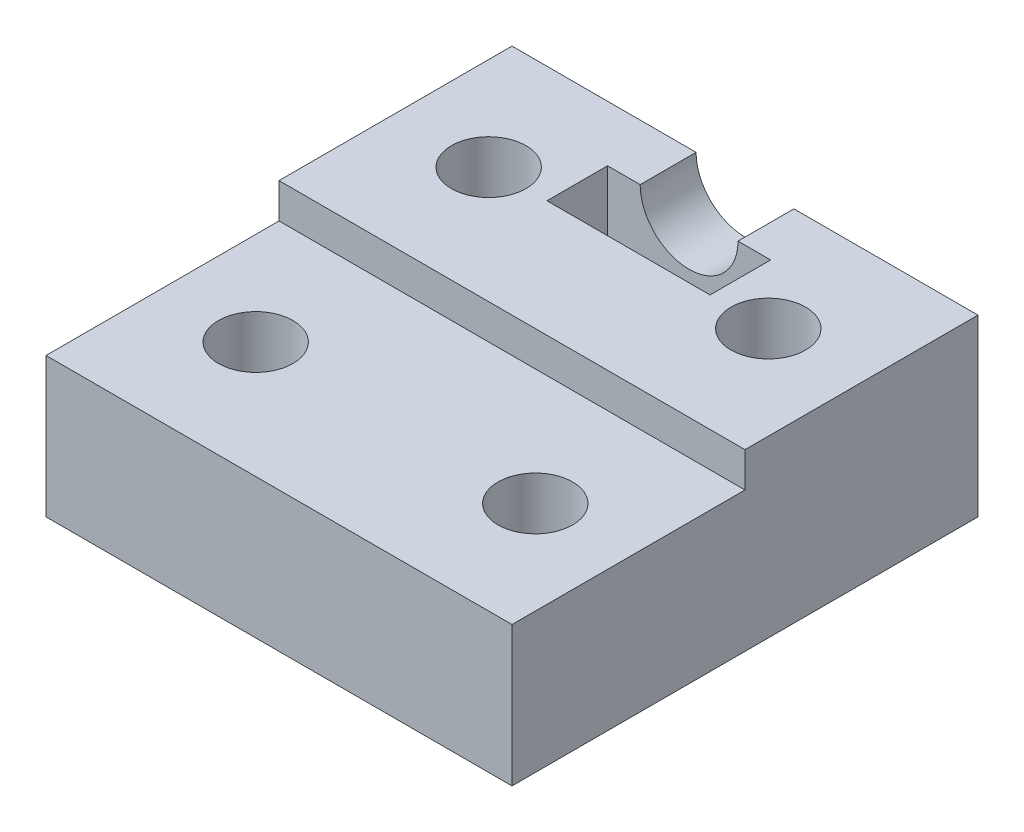
from build123d import *

# Parameters (mm, degrees)
SKETCH2_W                  = 20
SKETCH2_H                  = 20
BOSS_EXTRUDE1_DEPTH        = 7.5
SKETCH3_W                  = 20
SKETCH3_H                  = 3
CUT_EXTRUDE1_DEPTH         = 10
SKETCH4_W                  = 7
SKETCH4_H                  = 7
CUT_EXTRUDE2_DEPTH         = 2.6
SKETCH5_R                  = 2.1
CUT_EXTRUDE3_DEPTH         = 20.52562419
F_3_1_3_1_DIAMETER_HOLE1_D = 3.2
F_3_1_3_1_DIAMETER_HOLE2_D = 3.2


with BuildPart() as part:
    # Sketch2 → Boss-Extrude1 (new body)
    with BuildSketch(Plane(origin=(0, 0, 0), x_dir=(1, 0, 0), z_dir=(0, 1, 0))):
        Rectangle(SKETCH2_W, SKETCH2_H)
    extrude(amount=-BOSS_EXTRUDE1_DEPTH)

    # Sketch3 → Cut-Extrude1 (cut)
    with BuildSketch(Plane.XY.offset(10)):
        Rectangle(SKETCH3_W, SKETCH3_H)
    extrude(amount=-CUT_EXTRUDE1_DEPTH, mode=Mode.SUBTRACT)

    # Sketch4 → Cut-Extrude2 (cut)
    with BuildSketch(Plane.XY.offset(-5)):
        Rectangle(SKETCH4_W, SKETCH4_H)
    extrude(amount=-CUT_EXTRUDE2_DEPTH, mode=Mode.SUBTRACT)

    # Sketch5 → Cut-Extrude3 (cut, through all)
    with BuildSketch(Plane.XY.offset(-5)):
        Circle(SKETCH5_R)
    extrude(amount=-CUT_EXTRUDE3_DEPTH, mode=Mode.SUBTRACT)

    # Ø3.1 (3.1) Diameter Hole1 (through all)
    with Locations(Plane(origin=(0, -1.5, 0), x_dir=(1, 0, 0), z_dir=(0, 1, 0))):
        with Locations((-6, -5), (6, -5)):
            Hole(F_3_1_3_1_DIAMETER_HOLE1_D / 2)

    # Ø3.1 (3.1) Diameter Hole2 (through all)
    with Locations(Plane(origin=(0, 0, 0), x_dir=(1, 0, 0), z_dir=(0, 1, 0))):
        with Locations((-6, 5), (6, 5)):
            Hole(F_3_1_3_1_DIAMETER_HOLE2_D / 2)


solid = part.part
